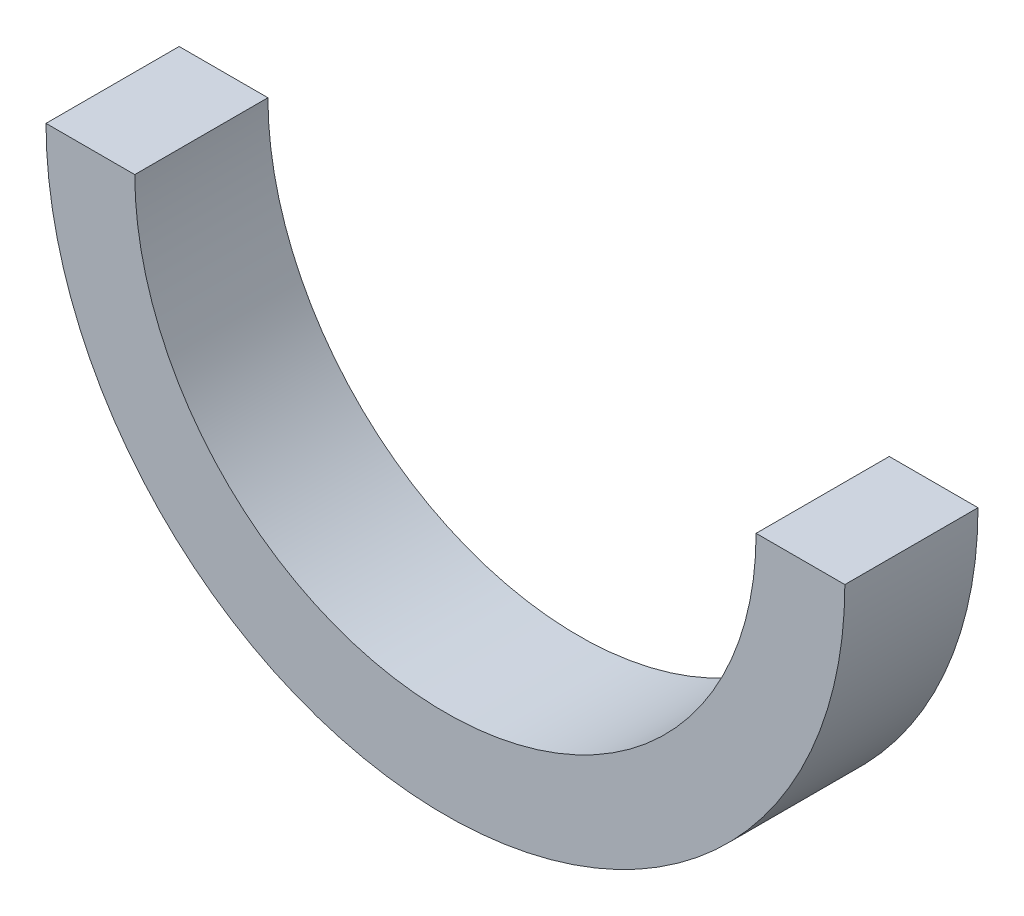
from build123d import *

# Parameters (mm, degrees)
SKETCH_1_W          = 10
SKETCH_1_H          = 15
SKETCH_3_W          = 151.32253872
SKETCH_3_H          = 68.728998759
CUT_EXTRUDE_1_DEPTH = 15


with BuildPart() as part:
    # 스케치1 → 회전1 (revolve)
    with BuildSketch(Plane(origin=(0, 0, 0), x_dir=(1, 0, 0), z_dir=(0, 1, 0))):
        with Locations((40, 0)):
            Rectangle(SKETCH_1_W, SKETCH_1_H)
    revolve(axis=Axis((0, 0, 210), (0, 0, -1)))

    # 스케치3 → 컷-돌출1 (cut, symmetric)
    with BuildSketch(Plane.XY):
        with Locations((-2.867677042, 34.36449938)):
            Rectangle(SKETCH_3_W, SKETCH_3_H)
    extrude(amount=CUT_EXTRUDE_1_DEPTH, both=True, mode=Mode.SUBTRACT)


solid = part.part
